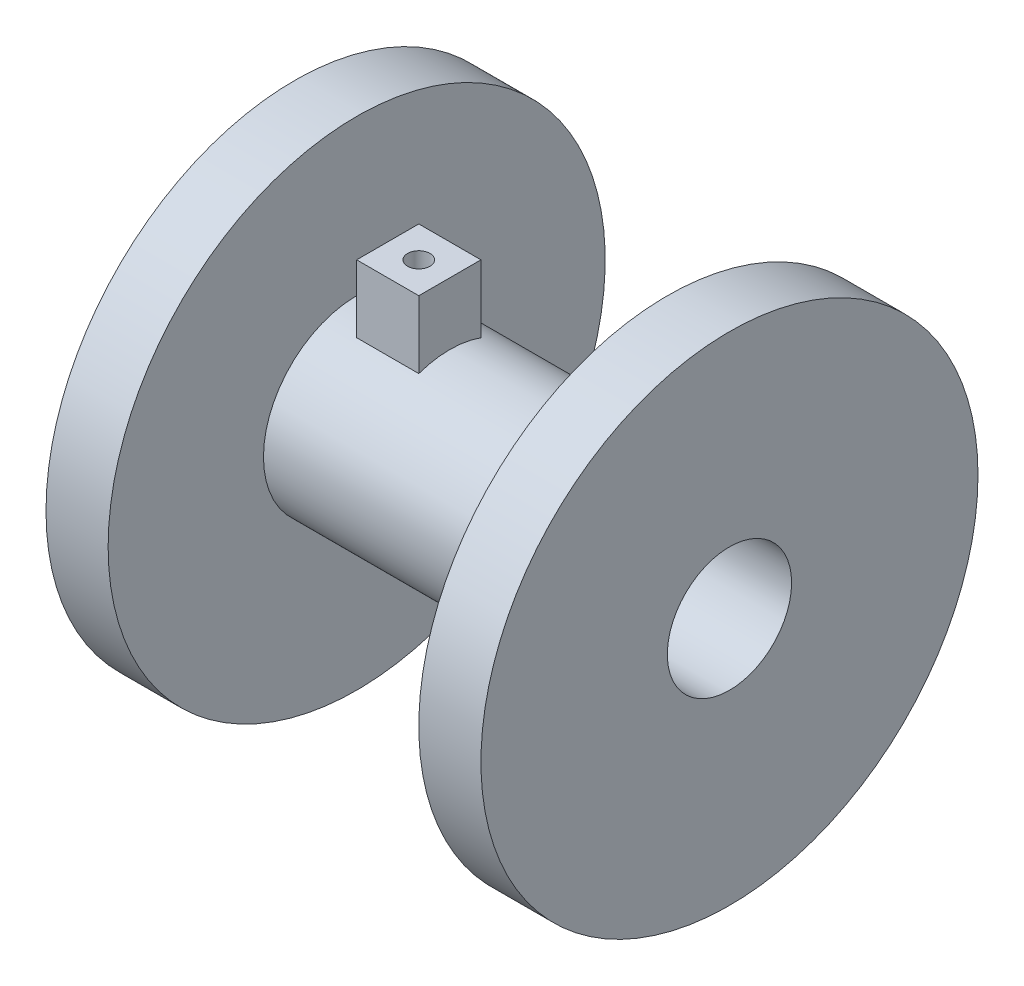
from build123d import *

# Parameters (mm, degrees)
SKETCH1_R                = 19.05
SKETCH1_R_2              = 12.7
BOSS_EXTRUDE1_DEPTH      = 44.45
BOSS_EXTRUDE2_START      = -12.7
SKETCH2_R                = 50.8
SKETCH2_R_2              = 12.7
BOSS_EXTRUDE2_DEPTH      = 12.7
SKETCH3_R                = 50.8
SKETCH3_R_2              = 12.7
BOSS_EXTRUDE3_DEPTH      = 12.7
BOSS_EXTRUDE4_REACH      = 118.231
BOSS_EXTRUDE4_END_RADIUS = 19.05
BOSS_EXTRUDE4_START      = 31.75
SKETCH4_W                = 12.7
SKETCH4_H                = 12.7
SKETCH4_R                = 2.286


with BuildPart() as part:
    # Sketch1 → Boss-Extrude1 (new, symmetric)
    with BuildSketch(Plane(origin=(0, 0, 0), x_dir=(0, 0, -1), z_dir=(1, 0, 0))):
        Circle(SKETCH1_R)
        Circle(SKETCH1_R_2, mode=Mode.SUBTRACT)
    extrude(amount=BOSS_EXTRUDE1_DEPTH, both=True)

    # Sketch2 → Boss-Extrude2 (add)
    with BuildSketch(Plane(origin=(44.45, 0, 0), x_dir=(0, 0, -1), z_dir=(1, 0, 0)).offset(BOSS_EXTRUDE2_START)):
        Circle(SKETCH2_R)
        Circle(SKETCH2_R_2, mode=Mode.SUBTRACT)
    extrude(amount=BOSS_EXTRUDE2_DEPTH)

    # Sketch3 → Boss-Extrude3 (add)
    with BuildSketch(Plane.ZY.offset(44.45)):
        with Locations(Location((0, 0, 0), (0, 0, 180))):
            Circle(SKETCH3_R)
        with Locations(Location((0, 0, 0), (0, 0, 180))):
            Circle(SKETCH3_R_2, mode=Mode.SUBTRACT)
    extrude(amount=-BOSS_EXTRUDE3_DEPTH)

    # Boss-Extrude4: up to this cylinder (the profile starts outside it)
    boss_extrude4_end = Plane(origin=(-19.05, 0, 0), z_dir=(-1, 0, 0)) * Cylinder(BOSS_EXTRUDE4_END_RADIUS, 275.562, mode=Mode.PRIVATE)
    # Sketch4 → Boss-Extrude4 (add, up to the surface)
    with BuildSketch(Plane(origin=(0, 0, 0), x_dir=(1, 0, 0), z_dir=(0, 1, 0)).offset(BOSS_EXTRUDE4_START), mode=Mode.PRIVATE) as boss_extrude4_sk1:
        with Locations((-19.05, 0)):
            Rectangle(SKETCH4_W, SKETCH4_H)
        with Locations(Location((-19.05, 0, 0), (0, 0, 270))):
            Circle(SKETCH4_R, mode=Mode.SUBTRACT)
    boss_extrude4_tool1 = extrude(boss_extrude4_sk1.sketch, amount=-BOSS_EXTRUDE4_REACH, mode=Mode.PRIVATE) - boss_extrude4_end
    add(boss_extrude4_tool1.solids().sort_by_distance((-19.05, 31.75, 6.170395))[0])


solid = part.part
